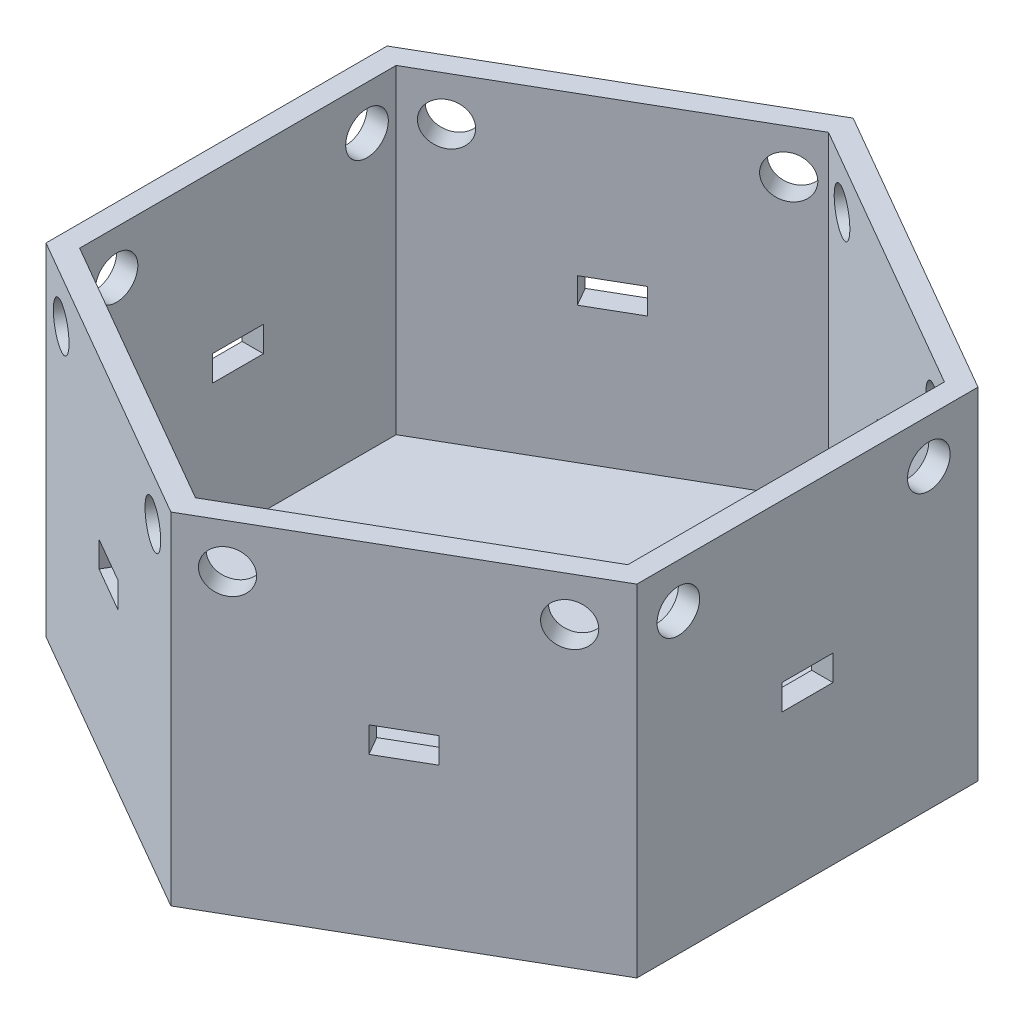
from build123d import *

# Parameters (mm, degrees)
BOSS_EXTRUDE1_DEPTH = 40
SHELL1_T            = -2.5
SKETCH2_R           = 5
CUT_EXTRUDE1_DEPTH  = 40
SKETCH3_R           = 2.5
CUT_EXTRUDE2_DEPTH  = 2.5
SKETCH4_W           = 6
SKETCH4_H           = 3
CUT_EXTRUDE3_DEPTH  = 40
CIRPATTERN1_COUNT   = 6


with BuildPart() as part:
    # Sketch1 → Boss-Extrude1 (new body)
    with BuildSketch(Plane(origin=(0, 0, 0), x_dir=(1, 0, 0), z_dir=(0, 1, 0))):
        Polygon((34.641016151, 20), (0, 40), (-34.641016151, 20), (-34.641016151, -20), (0, -40), (34.641016151, -20), align=None)
    extrude(amount=BOSS_EXTRUDE1_DEPTH)

    # Shell1
    shell1_openings = [part.faces().sort_by_distance(p)[0] for p in [
        (0, 40, 0),
    ]]
    offset(amount=SHELL1_T, openings=shell1_openings, kind=Kind.INTERSECTION)

    # Sketch2 → Cut-Extrude1 (cut)
    with BuildSketch(Plane.XZ):
        with Locations(Location((0, 0, 0), (0, 0, 270))):
            Circle(SKETCH2_R)
    extrude(amount=-CUT_EXTRUDE1_DEPTH, mode=Mode.SUBTRACT)

    # Sketch3 → Cut-Extrude2 (cut)
    with BuildSketch(Plane.ZY.offset(34.641016151)):
        with Locations((-15.137351835, 34.838276852)):
            Circle(SKETCH3_R)
        with Locations((14.232401454, 34.838276852)):
            Circle(SKETCH3_R)
    cut_extrude2 = extrude(amount=-CUT_EXTRUDE2_DEPTH, mode=Mode.SUBTRACT)

    # Sketch4 → Cut-Extrude3 (cut)
    with BuildSketch(Plane.ZY.offset(34.641016151)):
        with Locations((0, 20)):
            Rectangle(SKETCH4_W, SKETCH4_H)
    cut_extrude3 = extrude(amount=-CUT_EXTRUDE3_DEPTH, mode=Mode.SUBTRACT)

    # CirPattern1: Cut-Extrude2, Cut-Extrude3 ×6 about axis
    cirpattern1_axis = Axis((0, 0, 0), (0, 1, 0))
    add([cut_extrude2.rotate(cirpattern1_axis, i * 360 / CIRPATTERN1_COUNT) for i in range(1, CIRPATTERN1_COUNT)], mode=Mode.SUBTRACT)
    add([cut_extrude3.rotate(cirpattern1_axis, i * 360 / CIRPATTERN1_COUNT) for i in range(1, CIRPATTERN1_COUNT)], mode=Mode.SUBTRACT)


solid = part.part
